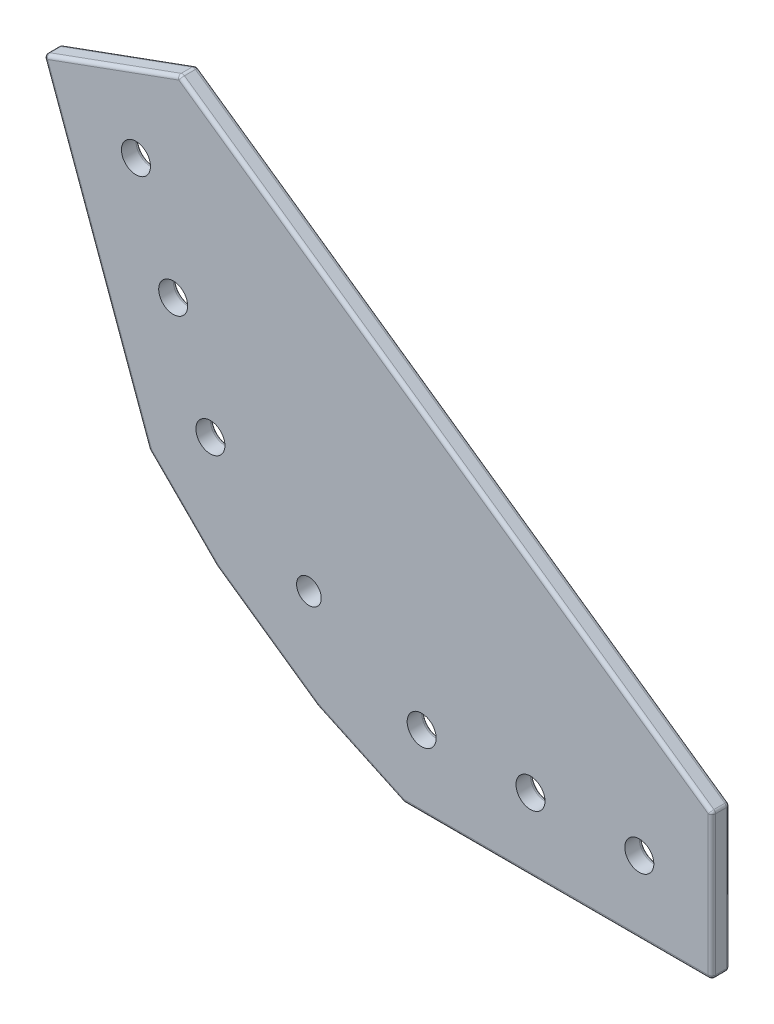
from build123d import *

# Parameters (mm, degrees)
BOSS_EXTRUDE1_DEPTH = 5
SKETCH2_R           = 4
CUT_EXTRUDE1_DEPTH  = 126.358624579
FILLET1_R           = 1
FILLET2_R           = 1
SKETCH3_R           = 3.4
CUT_EXTRUDE2_DEPTH  = 126.131404197


with BuildPart() as part:
    # Sketch1 → Boss-Extrude1 (new body)
    with BuildSketch(Plane.XY):
        Polygon((-53.472436825, -43.241064951), (-4.092360114, 27.280993176), (-63.57171988, 68.928889252), (-101.159424711, 55.248083519), (-72.087712528, -24.625789248), align=None)
        Polygon((-25.62126732, -62.742663787), (23.758809391, 7.779394341), (-4.092360114, 27.280993176), (-53.472436825, -43.241064951), align=None)
        Polygon((83.238169156, -73.868501735), (83.238169156, -33.868501735), (23.758809391, 7.779394341), (-25.62126732, -62.742663787), (-1.761830844, -73.868501735), align=None)
    extrude(amount=BOSS_EXTRUDE1_DEPTH)

    # Sketch2 → Cut-Extrude1 (cut, through all)
    with BuildSketch(Plane(origin=(0, 0, 0), x_dir=(-1, 0, 0), z_dir=(0, 0, -1))):
        with Locations((-63.238169156, -53.868501735)):
            Circle(SKETCH2_R)
        with Locations((-33.238169156, -53.868501735)):
            Circle(SKETCH2_R)
        with Locations((-3.238169156, -53.868501735)):
            Circle(SKETCH2_R)
        with Locations((75.525169429, 43.29463397)):
            Circle(SKETCH2_R)
        with Locations((65.264565129, 15.103855346)):
            Circle(SKETCH2_R)
        with Locations((55.003960829, -13.086923278)):
            Circle(SKETCH2_R)
    extrude(amount=-CUT_EXTRUDE1_DEPTH, mode=Mode.SUBTRACT)

    # Fillet1
    fillet1_edges = [part.edges().sort_by_distance(p)[0] for p in [
        (-72.087712528, -24.625789248, 2.5),
        (-101.159424711, 55.248083519, 2.5),
        (-63.57171988, 68.928889252, 2.5),
        (83.238169156, -33.868501735, 2.5),
        (83.238169156, -73.868501735, 2.5),
        (-1.761830844, -73.868501735, 2.5),
        (-25.62126732, -62.742663787, 2.5),
        (-53.472436825, -43.241064951, 2.5),
        (-71.525169429, 43.29463397, 0),
        (-51.003960829, -13.086923278, 0),
        (7.238169156, -53.868501735, 0),
        (37.238169156, -53.868501735, 0),
        (67.238169156, -53.868501735, 0),
        (-61.264565129, 15.103855346, 0),
    ]]
    fillet(fillet1_edges, radius=FILLET1_R)

    # Fillet2
    fillet2_edges = [part.edges().sort_by_distance(p)[0] for p in [
        (-62.732625691, -33.980876085, 0),
        (-86.490470568, 14.945463244, 0),
        (-82.140312493, 62.170474248, 0),
        (9.833224638, 17.530193758, 0),
        (83.238169156, -53.62878526, 0),
        (40.349016488, -73.868501735, 0),
        (-13.752365053, -68.277223808, 0),
        (-39.546852072, -52.991864369, 0),
        (82.945275938, -73.575608516, 0),
        (-1.756575795, -73.844797742, 0),
        (-25.619357401, -62.739355711, 0),
        (-72.067235394, -24.612743874, 0),
        (-53.469981481, -43.238138786, 0),
        (-100.784019734, 55.073029303, 0),
        (-63.58834656, 68.802597075, 0),
        (83.12517999, -33.927320172, 0),
        (9.833224638, 17.530193758, 5),
        (83.238169156, -53.62878526, 5),
        (-62.732625691, -33.980876085, 5),
        (-39.546852072, -52.991864369, 5),
        (-13.752365053, -68.277223808, 5),
        (40.349016488, -73.868501735, 5),
        (-82.140312493, 62.170474248, 5),
        (-86.490470568, 14.945463244, 5),
        (82.945275938, -73.575608516, 5),
        (-1.756575795, -73.844797742, 5),
        (-25.619357401, -62.739355711, 5),
        (-72.067235394, -24.612743874, 5),
        (-53.469981481, -43.238138786, 5),
        (-100.784019734, 55.073029303, 5),
        (-63.58834656, 68.802597075, 5),
        (83.12517999, -33.927320172, 5),
    ]]
    fillet(fillet2_edges, radius=FILLET2_R)

    # Sketch3 → Cut-Extrude2 (cut, through all)
    with BuildSketch(Plane.XY.offset(5)):
        with Locations((-27.84734626, -36.283238463)):
            Circle(SKETCH3_R)
    extrude(amount=-CUT_EXTRUDE2_DEPTH, mode=Mode.SUBTRACT)


solid = part.part
